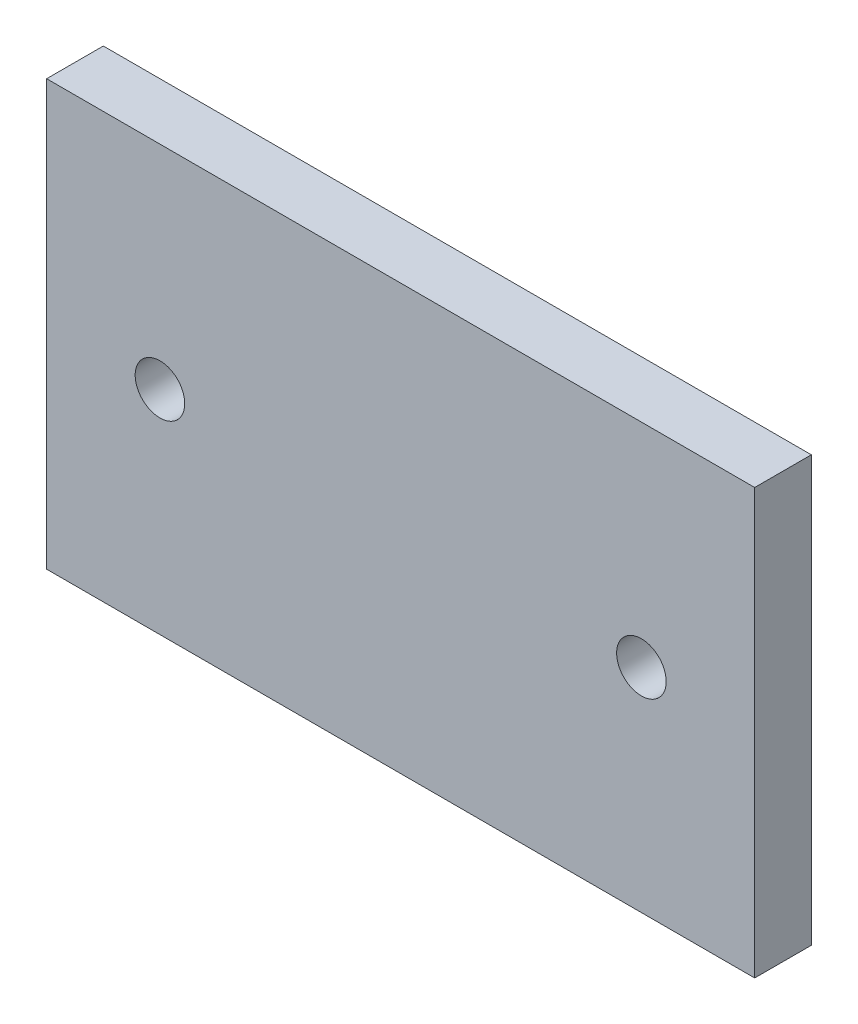
from build123d import *

# Parameters (mm, degrees)
SKETCH_1_W          = 200
SKETCH_1_H          = 120
EXTRUDE_1_DEPTH     = 16
SKETCH_2_R          = 7
CUT_EXTRUDE_1_DEPTH = 118.711511756


with BuildPart() as part:
    # 草图1 → 凸台-拉伸1 (new body)
    with BuildSketch(Plane.XY):
        Rectangle(SKETCH_1_W, SKETCH_1_H)
    extrude(amount=EXTRUDE_1_DEPTH)

    # 草图2 → 切除-拉伸1 (cut, through all)
    with BuildSketch(Plane.XY.offset(16)):
        with Locations((-68, 0)):
            Circle(SKETCH_2_R)
        with Locations((68, 0)):
            Circle(SKETCH_2_R)
    extrude(amount=-CUT_EXTRUDE_1_DEPTH, mode=Mode.SUBTRACT)


solid = part.part
